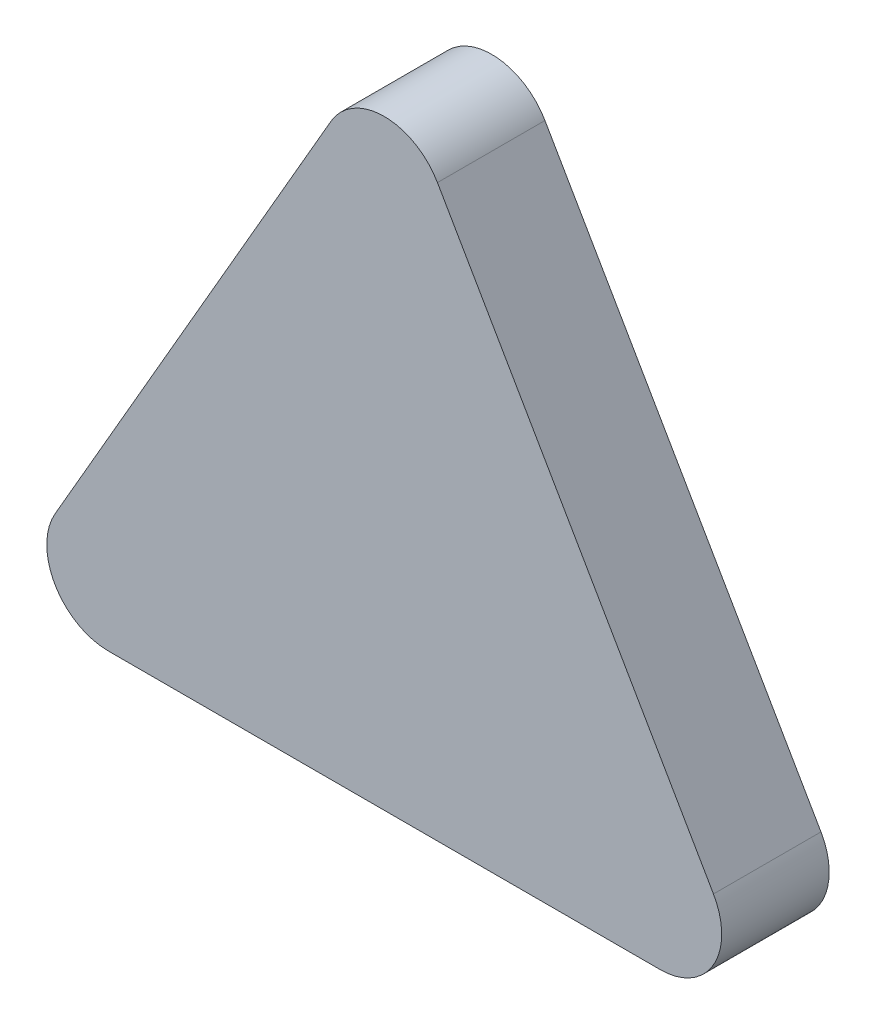
from build123d import *

# Parameters (mm, degrees)
BOSS_EXTRU_1_DEPTH      = 3.5
ESQUISSE2_W             = 4
ESQUISSE2_H             = 4
ENL_V_MAT_EXTRU_1_DEPTH = 2.9
CONG_1_R                = 2


with BuildPart() as part:
    # Esquisse1 → Boss.-Extru.1 (new body)
    with BuildSketch(Plane.XY):
        Polygon((-12.45, 0), (12.45, 0), (0, 21.564032554), align=None)
    extrude(amount=BOSS_EXTRU_1_DEPTH)

    # Esquisse2 → Enlèv. mat.-Extru.1 (cut)
    with BuildSketch(Plane(origin=(0, 0, 0), x_dir=(-1, 0, 0), z_dir=(0, 0, -1))):
        with Locations((0, 5.874833395)):
            Rectangle(ESQUISSE2_W, ESQUISSE2_H)
    extrude(amount=-ENL_V_MAT_EXTRU_1_DEPTH, mode=Mode.SUBTRACT)

    # Congé1
    cong_1_edges = [part.edges().sort_by_distance(p)[0] for p in [
        (0, 21.564032554, 1.75),
        (12.45, 0, 1.75),
        (-12.45, 0, 1.75),
    ]]
    fillet(cong_1_edges, radius=CONG_1_R)


solid = part.part
